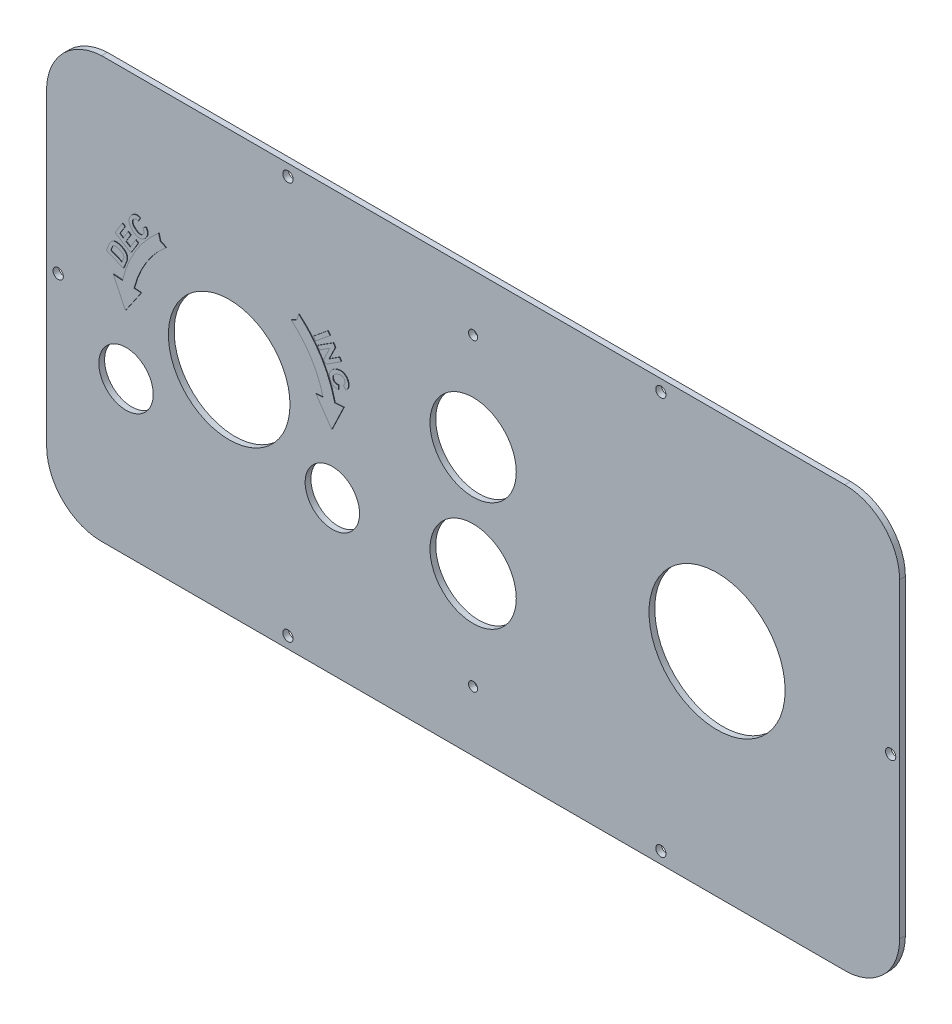
from build123d import *

# Parameters (mm, degrees)
SKETCH1_R           = 1.131526122
SKETCH1_R_2         = 1.143
SKETCH1_R_3         = 9.510305368
SKETCH1_R_4         = 1.001084776
BOSS_EXTRUDE1_DEPTH = 1.27
SKETCH2_R           = 14.9987
SKETCH2_R_2         = 13.3985
SKETCH2_R_3         = 5.9944
CUT_EXTRUDE1_DEPTH  = 3.81
BOSS_EXTRUDE2_DEPTH = 0.127
BOSS_EXTRUDE3_DEPTH = 0.127
BOSS_EXTRUDE4_DEPTH = 0.127


with BuildPart() as part:
    # Sketch1 → Boss-Extrude1 (new body)
    with BuildSketch(Plane.XY):
        with BuildLine():
            Line((-332.215807427, -23.144717109), (-168.411983061, -23.144717109))
            ThreePointArc((-168.411983061, -23.144717109), (-159.871485262, -26.682307127), (-156.333895244, -35.222804926))
            Line((-156.333895244, -35.222804926), (-156.333895244, -103.79002983))
            ThreePointArc((-156.333895244, -103.79002983), (-159.672699776, -112.127003681), (-167.843189436, -115.854717109))
            Line((-167.843189436, -115.854717109), (-332.215807427, -115.854717109))
            ThreePointArc((-332.215807427, -115.854717109), (-340.756305226, -112.317127091), (-344.293895244, -103.776629292))
            Line((-344.293895244, -103.776629292), (-344.293895244, -35.222804926))
            ThreePointArc((-344.293895244, -35.222804926), (-340.588683706, -26.849928647), (-332.215807427, -23.144717109))
        make_face()
        with Locations((-291.122652929, -113.311961779)):
            Circle(SKETCH1_R, mode=Mode.SUBTRACT)
        with Locations((-208.936343934, -113.311961779)):
            Circle(SKETCH1_R, mode=Mode.SUBTRACT)
        with Locations((-158.307856949, -69.499717109)):
            Circle(SKETCH1_R, mode=Mode.SUBTRACT)
        with Locations((-208.936343934, -25.687472439)):
            Circle(SKETCH1_R, mode=Mode.SUBTRACT)
        with Locations((-291.122652929, -25.687472439)):
            Circle(SKETCH1_R_2, mode=Mode.SUBTRACT)
        with Locations((-341.751139914, -69.499717109)):
            Circle(SKETCH1_R, mode=Mode.SUBTRACT)
        with Locations((-250.313895244, -81.066181689)):
            Circle(SKETCH1_R_3, mode=Mode.SUBTRACT)
        with Locations((-250.313895244, -56.936181689)):
            Circle(SKETCH1_R_3, mode=Mode.SUBTRACT)
        with Locations((-250.313895244, -35.516824401)):
            Circle(SKETCH1_R_4, mode=Mode.SUBTRACT)
        with Locations((-250.313895244, -102.589504364)):
            Circle(SKETCH1_R_4, mode=Mode.SUBTRACT)
    extrude(amount=BOSS_EXTRUDE1_DEPTH)

    # Sketch2 → Cut-Extrude1 (cut)
    with BuildSketch(Plane.XY.offset(1.27)):
        with Locations((-196.559414479, -69.001181689)):
            Circle(SKETCH2_R)
        with Locations((-304.06837601, -69.001181689)):
            Circle(SKETCH2_R_2)
        with Locations((-326.800474259, -82.125564733)):
            Circle(SKETCH2_R_3)
        with Locations((-281.336277761, -82.125564733)):
            Circle(SKETCH2_R_3)
    extrude(amount=-CUT_EXTRUDE1_DEPTH, mode=Mode.SUBTRACT)

    # Sketch3 → Boss-Extrude2 (add)
    with BuildSketch(Plane.XY.offset(1.27)):
        with BuildLine():
            Line((-329.447954554, -63.456874258), (-327.949543271, -66.594821243))
            ThreePointArc((-327.949543271, -66.594821243), (-327.750649732, -65.095975965), (-327.457779662, -63.612627413))
            Line((-327.457779662, -63.612627413), (-329.447954554, -63.456874258))
        make_face()
        with BuildLine():
            Line((-327.949543271, -66.594821243), (-326.800474259, -69.001181689))
            ThreePointArc((-326.800474259, -69.001181689), (-326.644015743, -66.338705126), (-326.176793913, -63.712878688))
            Line((-326.176793913, -63.712878688), (-327.457779662, -63.612627413))
            ThreePointArc((-327.457779662, -63.612627413), (-327.750649732, -65.095975965), (-327.949543271, -66.594821243))
        make_face()
        with BuildLine():
            ThreePointArc((-326.176793913, -63.712878688), (-326.644015743, -66.338705126), (-326.800474259, -69.001181689))
            Line((-326.800474259, -69.001181689), (-325.438635532, -67.017833711))
            ThreePointArc((-325.438635532, -67.017833711), (-325.227080322, -65.405226584), (-324.894014937, -63.813270303))
            Line((-324.894014937, -63.813270303), (-326.176793913, -63.712878688))
        make_face()
        with BuildLine():
            ThreePointArc((-324.894014937, -63.813270303), (-325.227080322, -65.405226584), (-325.438635532, -67.017833711))
            Line((-325.438635532, -67.017833711), (-323.322703325, -63.936242783))
            Line((-323.322703325, -63.936242783), (-324.894014937, -63.813270303))
        make_face()
        with BuildLine():
            ThreePointArc((-324.894014937, -63.813270303), (-322.270425296, -57.629855335), (-317.863946842, -52.560260588))
            Line((-317.863946842, -52.560260588), (-319.119965223, -51.965984215))
            ThreePointArc((-319.119965223, -51.965984215), (-323.554625384, -57.295013394), (-326.176793913, -63.712878688))
            Line((-326.176793913, -63.712878688), (-324.894014937, -63.813270303))
        make_face()
        with BuildLine():
            ThreePointArc((-326.176793913, -63.712878688), (-323.554625384, -57.295013394), (-319.119965223, -51.965984215))
            Line((-319.119965223, -51.965984215), (-319.496627371, -50.614507702))
            ThreePointArc((-319.496627371, -50.614507702), (-324.536408748, -56.464820327), (-327.457779662, -63.612627413))
            Line((-327.457779662, -63.612627413), (-326.176793913, -63.712878688))
        make_face()
        with BuildLine():
            Line((-284.814048695, -63.936242783), (-282.698116487, -67.017833711))
            ThreePointArc((-282.698116487, -67.017833711), (-282.909671698, -65.405226584), (-283.242737083, -63.813270303))
            Line((-283.242737083, -63.813270303), (-284.814048695, -63.936242783))
        make_face()
        with BuildLine():
            Line((-282.698116487, -67.017833711), (-281.336277761, -69.001181689))
            ThreePointArc((-281.336277761, -69.001181689), (-281.492736277, -66.338705126), (-281.959958107, -63.712878688))
            Line((-281.959958107, -63.712878688), (-283.242737083, -63.813270303))
            ThreePointArc((-283.242737083, -63.813270303), (-282.909671698, -65.405226584), (-282.698116487, -67.017833711))
        make_face()
        with BuildLine():
            ThreePointArc((-281.959958107, -63.712878688), (-281.492736277, -66.338705126), (-281.336277761, -69.001181689))
            Line((-281.336277761, -69.001181689), (-280.187208748, -66.594821243))
            ThreePointArc((-280.187208748, -66.594821243), (-280.386102288, -65.095975965), (-280.678972358, -63.612627413))
            Line((-280.678972358, -63.612627413), (-281.959958107, -63.712878688))
        make_face()
        with BuildLine():
            ThreePointArc((-280.678972358, -63.612627413), (-280.386102288, -65.095975965), (-280.187208748, -66.594821243))
            Line((-280.187208748, -66.594821243), (-278.688797466, -63.456874258))
            Line((-278.688797466, -63.456874258), (-280.678972358, -63.612627413))
        make_face()
        with BuildLine():
            Line((-288.640124649, -50.614507702), (-289.016786797, -51.965984215))
            ThreePointArc((-289.016786797, -51.965984215), (-284.582126636, -57.295013394), (-281.959958107, -63.712878688))
            Line((-281.959958107, -63.712878688), (-280.678972358, -63.612627413))
            ThreePointArc((-280.678972358, -63.612627413), (-283.600343272, -56.464820327), (-288.640124649, -50.614507702))
        make_face()
        with BuildLine():
            Line((-289.016786797, -51.965984215), (-290.272805177, -52.560260588))
            ThreePointArc((-290.272805177, -52.560260588), (-285.866326724, -57.629855335), (-283.242737083, -63.813270303))
            Line((-283.242737083, -63.813270303), (-281.959958107, -63.712878688))
            ThreePointArc((-281.959958107, -63.712878688), (-284.582126636, -57.295013394), (-289.016786797, -51.965984215))
        make_face()
    extrude(amount=BOSS_EXTRUDE2_DEPTH)

    # Sketch4 → Boss-Extrude3 (add)
    # profile 1 of 3: a face of its own
    with BuildSketch(Plane.XY.offset(1.27)):
        with BuildLine():
            Line((-322.988539788, -51.314655568), (-322.278959433, -50.880840201))
            add(Edge.make_bspline(
                [(-322.278959433, -50.880840201), (-322.248610089, -50.927882454), (-322.189434891, -51.019605512), (-322.114520348, -51.161444435), (-322.051821055, -51.301398471), (-322.000555596, -51.439943553), (-321.964721728, -51.57795691), (-321.940156801, -51.714419789), (-321.929374794, -51.849803349), (-321.932018936, -51.98402874), (-321.946829066, -52.116857271), (-321.974067586, -52.248338997), (-322.014255523, -52.378086211), (-322.06523213, -52.507267017), (-322.129793933, -52.634884693), (-322.207177102, -52.760842519), (-322.294807034, -52.886932706), (-322.362239222, -52.966486771), (-322.39667404, -53.007111727)],
                knots=[0, 0, 0, 0, 1.157851979, 2.257581565, 3.314782203, 4.32949787, 5.309965241, 6.261080568, 7.195080694, 8.114963262, 9.034705662, 9.95663574, 10.888701331, 11.841746345, 12.826870766, 13.84337954, 14.898703503, 16, 16, 16, 16], degree=3))
            add(Edge.make_bspline(
                [(-322.39667404, -53.007111727), (-322.44101249, -53.055796639), (-322.528071025, -53.151389448), (-322.67246006, -53.27634613), (-322.822479571, -53.384890549), (-322.981188251, -53.472689047), (-323.145404887, -53.545649536), (-323.317977679, -53.598152661), (-323.497328971, -53.632772858), (-323.682377506, -53.648913203), (-323.870399195, -53.64731998), (-324.058700673, -53.622243458), (-324.24615122, -53.579328741), (-324.431640037, -53.512523584), (-324.616598203, -53.427892194), (-324.79979604, -53.321224487), (-324.98258997, -53.195210994), (-325.098826263, -53.098083821), (-325.158439805, -53.048270681)],
                knots=[0, 0, 0, 0, 1.015475193, 1.993885241, 2.941039742, 3.868158427, 4.787897332, 5.709486723, 6.645489718, 7.602073748, 8.571923292, 9.541032916, 10.528183585, 11.534041445, 12.578111957, 13.663308782, 14.801592556, 16, 16, 16, 16], degree=3))
            add(Edge.make_bspline(
                [(-325.158439805, -53.048270681), (-325.219476194, -52.993539555), (-325.338221645, -52.887060905), (-325.496134403, -52.715293878), (-325.635302894, -52.542493786), (-325.751288469, -52.365181174), (-325.847568117, -52.185455449), (-325.921002133, -52.002084611), (-325.973630469, -51.815580386), (-326.003818702, -51.626887397), (-326.013723994, -51.43867678), (-326.00385302, -51.252967143), (-325.974509279, -51.070842259), (-325.923165083, -50.892943089), (-325.854165088, -50.718134331), (-325.763137784, -50.547806568), (-325.652861869, -50.380994398), (-325.566364946, -50.276415128), (-325.522284952, -50.223120127)],
                knots=[0, 0, 0, 0, 1.221547282, 2.376503379, 3.474077779, 4.525849133, 5.530487973, 6.508891238, 7.46470517, 8.413631275, 9.351693911, 10.269331541, 11.181261778, 12.095482908, 13.024511195, 13.97789723, 14.969509271, 16, 16, 16, 16], degree=3))
            add(Edge.make_bspline(
                [(-325.522284952, -50.223120127), (-325.481566874, -50.178244618), (-325.401934899, -50.090481994), (-325.272706936, -49.973153178), (-325.13905849, -49.871142447), (-325.000327429, -49.785246875), (-324.857116949, -49.714467623), (-324.709164912, -49.660237888), (-324.556727051, -49.620330446), (-324.452631727, -49.607332307), (-324.400291885, -49.600796753)],
                knots=[0, 0, 0, 0, 1.104921298, 2.16088453, 3.179070944, 4.168133353, 5.13300952, 6.088005593, 7.038636127, 8, 8, 8, 8], degree=3))
            add(Edge.make_bspline(
                [(-324.400291885, -49.600796753), (-324.368484163, -49.598310955), (-324.304095006, -49.593278892), (-324.205715552, -49.596191786), (-324.104957442, -49.607656696), (-324.001209171, -49.624008502), (-323.895446094, -49.651557027), (-323.786897841, -49.684756055), (-323.676148622, -49.727353858), (-323.602486402, -49.760158388), (-323.564765134, -49.776957074)],
                knots=[0, 0, 0, 0, 0.885675298, 1.792894353, 2.727952824, 3.701478465, 4.70702385, 5.760441908, 6.853157414, 8, 8, 8, 8], degree=3))
            Line((-323.564765134, -49.776957074), (-323.950012937, -50.514525516))
            add(Edge.make_bspline(
                [(-323.950012937, -50.514525516), (-323.997123908, -50.491815633), (-324.088556733, -50.447740362), (-324.233750957, -50.409151435), (-324.378977574, -50.397539354), (-324.499000217, -50.409017186), (-324.592829881, -50.429087), (-324.661053264, -50.452264046), (-324.727697805, -50.479429926), (-324.791319178, -50.514962464), (-324.853154933, -50.554776931), (-324.912052562, -50.602016732), (-324.969696129, -50.653880028), (-325.004847806, -50.693091958), (-325.022615259, -50.712911671)],
                knots=[0, 0, 0, 0, 1.585254976, 3.076657889, 4.530995813, 5.986764843, 6.720537872, 7.439788765, 8.17166745, 8.902407172, 9.648794791, 10.402170907, 11.192375542, 12, 12, 12, 12], degree=3))
            add(Edge.make_bspline(
                [(-325.022615259, -50.712911671), (-325.046025193, -50.741249419), (-325.09185105, -50.796721662), (-325.148653115, -50.886543264), (-325.195183782, -50.978259027), (-325.231189278, -51.07275806), (-325.254989323, -51.170096898), (-325.267368203, -51.270111462), (-325.268652152, -51.372442829), (-325.260312219, -51.477581495), (-325.236543616, -51.584867191), (-325.198419565, -51.693717341), (-325.144668716, -51.8041311), (-325.076186162, -51.91614849), (-324.991226522, -52.028625929), (-324.892597339, -52.143581271), (-324.779217712, -52.260651244), (-324.694962513, -52.33540361), (-324.6513615, -52.374087026)],
                knots=[0, 0, 0, 0, 0.913225666, 1.787674721, 2.635964877, 3.467291952, 4.296375981, 5.12152001, 5.967694623, 6.837472799, 7.738148025, 8.691919004, 9.6989912, 10.786093483, 11.951486388, 13.199983436, 14.551026426, 16, 16, 16, 16], degree=3))
            add(Edge.make_bspline(
                [(-324.6513615, -52.374087026), (-324.604261288, -52.41377873), (-324.513387008, -52.490359172), (-324.376214879, -52.593618109), (-324.243016465, -52.680633928), (-324.114843463, -52.752764758), (-323.99105789, -52.809412488), (-323.872029462, -52.850411266), (-323.757426681, -52.87603748), (-323.647210293, -52.884960228), (-323.541736005, -52.880626732), (-323.440864278, -52.86557026), (-323.343775264, -52.84155552), (-323.251807489, -52.804154206), (-323.163264187, -52.758457692), (-323.07972665, -52.701009762), (-323.000735916, -52.632840419), (-322.952919377, -52.580930052), (-322.928447716, -52.554363241)],
                knots=[0, 0, 0, 0, 1.505049996, 2.903815681, 4.192700708, 5.390433225, 6.494784746, 7.51474674, 8.461717563, 9.356592667, 10.208849525, 11.035775279, 11.845697339, 12.646350717, 13.456161737, 14.276372174, 15.117877671, 16, 16, 16, 16], degree=3))
            add(Edge.make_bspline(
                [(-322.928447716, -52.554363241), (-322.911335665, -52.533797462), (-322.877519128, -52.493155727), (-322.833996876, -52.428070296), (-322.797633934, -52.360987067), (-322.767608887, -52.292209035), (-322.744577319, -52.221068456), (-322.727872832, -52.14782187), (-322.71909467, -52.072222967), (-322.716471651, -51.994827526), (-322.721389161, -51.915396493), (-322.734776705, -51.834365614), (-322.756606938, -51.751561358), (-322.786097112, -51.666950756), (-322.824756757, -51.58087727), (-322.870446041, -51.492716178), (-322.926422792, -51.40385672), (-322.967445738, -51.344947012), (-322.988539788, -51.314655568)],
                knots=[0, 0, 0, 0, 0.946926269, 1.871299235, 2.766985171, 3.646073041, 4.524892365, 5.411253504, 6.301918295, 7.215761873, 8.150394113, 9.115247673, 10.119232682, 11.179432306, 12.284415808, 13.457897079, 14.692847557, 16, 16, 16, 16], degree=3))
        make_face()
    # profile 2 of 3: a face of its own
    with BuildSketch(Plane.XY.offset(1.27)):
        Polygon((-325.608810025, -57.425881819), (-329.078509786, -55.282323532), (-327.488951011, -52.709065772), (-326.902024337, -53.07208774), (-328.058590924, -54.944820115), (-327.288918498, -55.419794436), (-326.213023459, -53.677947533), (-325.628566322, -54.039323142), (-326.704461361, -55.781170045), (-325.760274973, -56.363980824), (-324.562549432, -54.425394124), (-323.978092296, -54.786769734), align=None)
    # profile 3 of 3: a face of its own
    with BuildSketch(Plane.XY.offset(1.27)):
        with BuildLine():
            Line((-331.007938962, -59.62640957), (-330.431713616, -58.235236949))
            add(Edge.make_bspline(
                [(-330.431713616, -58.235236949), (-330.415673159, -58.197305711), (-330.384516119, -58.123627943), (-330.336811573, -58.017671352), (-330.290312466, -57.919312615), (-330.242785578, -57.829872698), (-330.198220631, -57.747072197), (-330.152779244, -57.673146616), (-330.1084623, -57.606810228), (-330.077667914, -57.566400008), (-330.062929395, -57.54705925)],
                knots=[0, 0, 0, 0, 1.262271306, 2.45184017, 3.561576223, 4.596098327, 5.555961161, 6.443056547, 7.254830384, 8, 8, 8, 8], degree=3))
            add(Edge.make_bspline(
                [(-330.062929395, -57.54705925), (-330.04298217, -57.523136867), (-330.003516153, -57.475805913), (-329.938360109, -57.410872807), (-329.871429571, -57.34959883), (-329.799740848, -57.294342914), (-329.725368401, -57.243081833), (-329.646438102, -57.198128888), (-329.565270799, -57.156447101), (-329.451164663, -57.109519288), (-329.301990428, -57.061661457), (-329.114727268, -57.024681802), (-328.919319049, -57.008697111), (-328.751804151, -57.011235352), (-328.613270822, -57.024475717), (-328.504525781, -57.040320658), (-328.391798631, -57.061499411), (-328.275759537, -57.089865723), (-328.15611574, -57.123849283), (-328.032656686, -57.163129385), (-327.905744796, -57.209580236), (-327.820496598, -57.243892935), (-327.77696113, -57.261416114)],
                knots=[0, 0, 0, 0, 0.752629623, 1.48909402, 2.221814292, 2.945013406, 3.675477993, 4.403679906, 5.139426909, 5.879854265, 7.384075305, 8.919237438, 10.483801334, 12.115916514, 12.962153698, 13.846831698, 14.771875432, 15.734041852, 16.733647288, 17.778413583, 18.865456303, 20, 20, 20, 20], degree=3))
            add(Edge.make_bspline(
                [(-327.77696113, -57.261416114), (-327.702330058, -57.293759224), (-327.558383283, -57.356141907), (-327.358289209, -57.465032781), (-327.178887615, -57.579707364), (-327.073190944, -57.667023929), (-327.022105926, -57.709225526)],
                knots=[0, 0, 0, 0, 1.106874826, 2.134915903, 3.098572802, 4, 4, 4, 4], degree=3))
            add(Edge.make_bspline(
                [(-327.022105926, -57.709225526), (-326.993611586, -57.735321029), (-326.937354537, -57.786841997), (-326.858277497, -57.867181107), (-326.786555986, -57.950105205), (-326.720494694, -58.033877412), (-326.660769514, -58.119728783), (-326.608546402, -58.207749554), (-326.56145075, -58.296970469), (-326.535964596, -58.358498767), (-326.523259413, -58.389171434)],
                knots=[0, 0, 0, 0, 1.089450147, 2.150927111, 3.17651831, 4.179532554, 5.158257719, 6.122966268, 7.064273991, 8, 8, 8, 8], degree=3))
            add(Edge.make_bspline(
                [(-326.523259413, -58.389171434), (-326.50622965, -58.437359784), (-326.47123633, -58.536378799), (-326.44435483, -58.696828531), (-326.433015146, -58.869317438), (-326.440404707, -58.987905021), (-326.444234222, -59.049361045)],
                knots=[0, 0, 0, 0, 0.912997572, 1.8760576, 2.899302531, 4, 4, 4, 4], degree=3))
            add(Edge.make_bspline(
                [(-326.444234222, -59.049361045), (-326.446687962, -59.073819554), (-326.451754127, -59.124318332), (-326.465391682, -59.202034078), (-326.483781927, -59.284004046), (-326.505502052, -59.370809445), (-326.5344898, -59.460860763), (-326.564968996, -59.556110308), (-326.602791866, -59.654741272), (-326.629641919, -59.721933355), (-326.643443556, -59.756471862)],
                knots=[0, 0, 0, 0, 0.799921899, 1.651575607, 2.566103244, 3.534439453, 4.562786193, 5.644552829, 6.789237896, 8, 8, 8, 8], degree=3))
            Line((-326.643443556, -59.756471862), (-327.236955662, -61.188803436))
            Line((-327.236955662, -61.188803436), (-331.007938962, -59.62640957))
        make_face()
        with BuildLine():
            Line((-330.054697604, -59.129209414), (-327.557172319, -60.163945499))
            Line((-327.557172319, -60.163945499), (-327.321743106, -59.595951944))
            add(Edge.make_bspline(
                [(-327.321743106, -59.595951944), (-327.311223399, -59.570195867), (-327.290915507, -59.520474748), (-327.263140532, -59.448217292), (-327.23806325, -59.381120195), (-327.216705197, -59.319153794), (-327.199315702, -59.261988661), (-327.185410405, -59.210359497), (-327.174158798, -59.163777381), (-327.169291924, -59.134180727), (-327.166985442, -59.120154444)],
                knots=[0, 0, 0, 0, 1.331702558, 2.570800627, 3.705312895, 4.760326005, 5.707644138, 6.564708635, 7.319794619, 8, 8, 8, 8], degree=3))
            add(Edge.make_bspline(
                [(-327.166985442, -59.120154444), (-327.162882907, -59.087010326), (-327.154865983, -59.022242095), (-327.156715926, -58.926208593), (-327.169922543, -58.834668914), (-327.194534385, -58.745896018), (-327.236439049, -58.658544022), (-327.298335598, -58.571510006), (-327.379687414, -58.482996396), (-327.461720462, -58.410094053), (-327.537881018, -58.351465729), (-327.602639791, -58.304935567), (-327.675698997, -58.260365326), (-327.75423931, -58.213883243), (-327.840271799, -58.168969664), (-327.932668981, -58.123463846), (-328.032140805, -58.078384132), (-328.10122325, -58.04930868), (-328.136690381, -58.034381257)],
                knots=[0, 0, 0, 0, 1.009870733, 1.973428268, 2.896624603, 3.80357663, 4.750890225, 5.812994407, 7.024201617, 8.382949079, 9.128855302, 9.933097914, 10.794969991, 11.718016881, 12.695116527, 13.731416487, 14.835302511, 16, 16, 16, 16], degree=3))
            add(Edge.make_bspline(
                [(-328.136690381, -58.034381257), (-328.172304174, -58.019971564), (-328.24132035, -57.992046937), (-328.342401782, -57.953836644), (-328.438494307, -57.922059882), (-328.528703178, -57.893270422), (-328.614432151, -57.871740195), (-328.694311283, -57.852735247), (-328.769174616, -57.840574433), (-328.85997716, -57.830767016), (-328.96556431, -57.827850256), (-329.084755205, -57.837811597), (-329.194837696, -57.858832744), (-329.295130954, -57.896092507), (-329.387550131, -57.945430569), (-329.472763239, -58.008499465), (-329.551171521, -58.085924778), (-329.595596046, -58.14595792), (-329.618412699, -58.176791235)],
                knots=[0, 0, 0, 0, 1.131293936, 2.192341155, 3.181157251, 4.111427988, 4.979588605, 5.783238915, 6.528426827, 7.21101846, 8.471888803, 9.631367896, 10.727907562, 11.760611836, 12.769169598, 13.803421516, 14.871826562, 16, 16, 16, 16], degree=3))
            add(Edge.make_bspline(
                [(-329.618412699, -58.176791235), (-329.627312897, -58.190436646), (-329.646961977, -58.220561794), (-329.676471389, -58.272014853), (-329.708961684, -58.333317506), (-329.744718286, -58.404518739), (-329.782075355, -58.486126596), (-329.823473404, -58.57766993), (-329.867638825, -58.679212197), (-329.89755388, -58.750511731), (-329.913110805, -58.787590102)],
                knots=[0, 0, 0, 0, 0.575712002, 1.27100666, 2.095346442, 3.027829159, 4.086524015, 5.267187378, 6.578837276, 8, 8, 8, 8], degree=3))
            Line((-329.913110805, -58.787590102), (-330.054697604, -59.129209414))
        make_face(mode=Mode.SUBTRACT)
    extrude(amount=BOSS_EXTRUDE3_DEPTH)

    # Sketch5 → Boss-Extrude4 (add)
    with BuildSketch(Plane.XY.offset(1.27)):
        with BuildLine():
            Line((-279.89055027, -59.786910982), (-279.812348259, -60.61667548))
            add(Edge.make_bspline(
                [(-279.812348259, -60.61667548), (-279.86798217, -60.623243499), (-279.976535655, -60.636059087), (-280.137231756, -60.641368759), (-280.290979088, -60.636770953), (-280.438070253, -60.621548336), (-280.578289027, -60.59425179), (-280.711600334, -60.555601791), (-280.838592307, -60.506184166), (-280.958252754, -60.444780197), (-281.071555048, -60.373254951), (-281.177155753, -60.289908532), (-281.277361008, -60.197662151), (-281.370519531, -60.094159356), (-281.457179776, -59.980122804), (-281.536708696, -59.85542139), (-281.610699353, -59.720884392), (-281.652855297, -59.625633554), (-281.674379305, -59.57700032)],
                knots=[0, 0, 0, 0, 1.156785401, 2.257132128, 3.317631308, 4.332302743, 5.308320334, 6.264433565, 7.195969362, 8.118703158, 9.038594842, 9.959289483, 10.893855457, 11.848976877, 12.831866588, 13.849146945, 14.90181609, 16, 16, 16, 16], degree=3))
            add(Edge.make_bspline(
                [(-281.674379305, -59.57700032), (-281.698601245, -59.515669383), (-281.746139846, -59.395299706), (-281.796280095, -59.210761296), (-281.827424352, -59.027693402), (-281.838029882, -58.846068623), (-281.82973969, -58.665919951), (-281.802733905, -58.487522127), (-281.755040751, -58.310737542), (-281.68836682, -58.137098466), (-281.60423551, -57.968036907), (-281.499776801, -57.808855657), (-281.377548811, -57.659619997), (-281.238034673, -57.520022394), (-281.079563377, -57.3913426), (-280.903310323, -57.272835905), (-280.709349848, -57.163487711), (-280.570762684, -57.101421195), (-280.499702779, -57.069596886)],
                knots=[0, 0, 0, 0, 1.01465447, 1.991386966, 2.938053213, 3.869121133, 4.786866433, 5.710002526, 6.641539992, 7.600336576, 8.569584703, 9.543343185, 10.525169912, 11.534895786, 12.576767575, 13.662990432, 14.801709525, 16, 16, 16, 16], degree=3))
            add(Edge.make_bspline(
                [(-280.499702779, -57.069596886), (-280.423605487, -57.038688525), (-280.275490711, -56.978528893), (-280.051253568, -56.911719913), (-279.834429259, -56.86248148), (-279.623482928, -56.836290873), (-279.419533457, -56.828998409), (-279.221801385, -56.842595315), (-279.030940454, -56.878553972), (-278.847199259, -56.933244584), (-278.673628157, -57.007965716), (-278.510344269, -57.097567303), (-278.359568091, -57.204480601), (-278.221342048, -57.328223377), (-278.094739882, -57.467957832), (-277.981312158, -57.624547526), (-277.878816878, -57.796471711), (-277.823162795, -57.920152987), (-277.794736369, -57.983325649)],
                knots=[0, 0, 0, 0, 1.221265658, 2.377055557, 3.476451972, 4.525558574, 5.534372626, 6.508394098, 7.467563619, 8.418077017, 9.354487021, 10.273555015, 11.184198742, 12.097811198, 13.028410784, 13.983706967, 14.970138372, 16, 16, 16, 16], degree=3))
            add(Edge.make_bspline(
                [(-277.794736369, -57.983325649), (-277.772079922, -58.039773845), (-277.727806223, -58.150081094), (-277.679196167, -58.318218848), (-277.646762986, -58.48352493), (-277.630123488, -58.646108001), (-277.628855363, -58.806078738), (-277.644765718, -58.963305172), (-277.676475678, -59.118247777), (-277.710259917, -59.21812318), (-277.727235685, -59.268308171)],
                knots=[0, 0, 0, 0, 1.105987578, 2.161246202, 3.178402366, 4.166833954, 5.130256646, 6.083421502, 7.036965341, 8, 8, 8, 8], degree=3))
            add(Edge.make_bspline(
                [(-277.727235685, -59.268308171), (-277.73906859, -59.298171092), (-277.762979091, -59.358514466), (-277.808869955, -59.44591026), (-277.862875924, -59.531581315), (-277.923889821, -59.616991932), (-277.993984808, -59.700709227), (-278.072440387, -59.782778477), (-278.15838341, -59.86425391), (-278.220543981, -59.915424877), (-278.252423929, -59.941668647)],
                knots=[0, 0, 0, 0, 0.891481387, 1.801397611, 2.735866343, 3.702221906, 4.713895134, 5.764861339, 6.853676821, 8, 8, 8, 8], degree=3))
            Line((-278.252423929, -59.941668647), (-278.747977727, -59.272424066))
            add(Edge.make_bspline(
                [(-278.747977727, -59.272424066), (-278.726877339, -59.256541271), (-278.685123501, -59.2251121), (-278.627783688, -59.173423248), (-278.576182441, -59.118719818), (-278.530907835, -59.061007617), (-278.491138856, -59.000349009), (-278.456364529, -58.937312012), (-278.428248774, -58.870747436), (-278.406292536, -58.801800557), (-278.389622233, -58.731377519), (-278.379985393, -58.659710799), (-278.375279915, -58.587561048), (-278.379224724, -58.514855627), (-278.38812962, -58.441589845), (-278.403861546, -58.367798515), (-278.426102599, -58.293153774), (-278.445746045, -58.244403397), (-278.455749158, -58.219578041)],
                knots=[0, 0, 0, 0, 1.066303857, 2.110021862, 3.113603657, 4.10021359, 5.068476909, 6.040538346, 7.003905473, 7.98176204, 8.960309205, 9.922655816, 10.899507004, 11.875792211, 12.858660247, 13.878088571, 14.919450285, 16, 16, 16, 16], degree=3))
            add(Edge.make_bspline(
                [(-278.455749158, -58.219578041), (-278.47095609, -58.18601008), (-278.500759736, -58.120221158), (-278.556648446, -58.029577515), (-278.61835434, -57.947136793), (-278.688269045, -57.874244234), (-278.765028439, -57.80957281), (-278.849624765, -57.754100738), (-278.941460063, -57.708142707), (-279.040204838, -57.67042614), (-279.146826076, -57.644117339), (-279.261762151, -57.630136901), (-279.38460316, -57.629834862), (-279.515466523, -57.642688686), (-279.654161879, -57.668667847), (-279.800525671, -57.707978434), (-279.955385487, -57.759126291), (-280.059544494, -57.801582439), (-280.113631797, -57.823628911)],
                knots=[0, 0, 0, 0, 0.914273875, 1.791860207, 2.638125267, 3.467041424, 4.29407919, 5.125595633, 5.972710592, 6.839571693, 7.745172014, 8.692563272, 9.707819813, 10.789216937, 11.953234669, 13.207630936, 14.549988929, 16, 16, 16, 16], degree=3))
            add(Edge.make_bspline(
                [(-280.113631797, -57.823628911), (-280.17015416, -57.84856484), (-280.279232761, -57.896686965), (-280.432453999, -57.975624834), (-280.569736255, -58.057136241), (-280.69124568, -58.1407293), (-280.796529734, -58.227155186), (-280.885786223, -58.316455912), (-280.958686542, -58.408805096), (-281.016187437, -58.503520097), (-281.059463982, -58.599915004), (-281.089568554, -58.69740993), (-281.110075926, -58.795499681), (-281.118129804, -58.894441589), (-281.114951863, -58.994194627), (-281.099297034, -59.094439434), (-281.07471034, -59.196201883), (-281.048235823, -59.262002587), (-281.034769171, -59.29547308)],
                knots=[0, 0, 0, 0, 1.506177776, 2.906668321, 4.199880058, 5.397025259, 6.499580984, 7.516793748, 8.46981648, 9.361413153, 10.211971909, 11.039399476, 11.845088862, 12.650778249, 13.454130525, 14.272636779, 15.12135136, 16, 16, 16, 16], degree=3))
            add(Edge.make_bspline(
                [(-281.034769171, -59.29547308), (-281.023692721, -59.319851978), (-281.001823031, -59.367986436), (-280.9616663, -59.435261802), (-280.918588071, -59.498754494), (-280.868151079, -59.555148332), (-280.815454745, -59.608587744), (-280.75573465, -59.654521317), (-280.692674177, -59.696942413), (-280.62388276, -59.733105362), (-280.550431163, -59.763695479), (-280.471680998, -59.787961763), (-280.387385597, -59.803586289), (-280.298071611, -59.814882989), (-280.203340325, -59.817546864), (-280.103562214, -59.814160783), (-279.998539882, -59.804273461), (-279.927262038, -59.792813469), (-279.89055027, -59.786910982)],
                knots=[0, 0, 0, 0, 0.944291557, 1.864438728, 2.761726336, 3.647230549, 4.530614044, 5.406320435, 6.300729177, 7.210472501, 8.143875898, 9.105780662, 10.112373434, 11.165811367, 12.280162125, 13.452584408, 14.68794952, 16, 16, 16, 16], degree=3))
        make_face()
        Polygon((-284.423563116, -54.498378357), (-280.991729591, -52.304606147), (-280.560383761, -52.978789802), (-281.954025919, -55.849215204), (-279.6622954, -54.383956467), (-279.250705868, -55.027682496), (-282.682539392, -57.221454706), (-283.127056088, -56.525868396), (-281.773749704, -53.71141917), (-284.011973583, -55.142104386), align=None)
        Polygon((-285.402696897, -53.223153433), (-282.235103852, -50.630139376), (-281.711561966, -51.26974951), (-284.879155011, -53.862763567), align=None)
    extrude(amount=BOSS_EXTRUDE4_DEPTH)


solid = part.part
